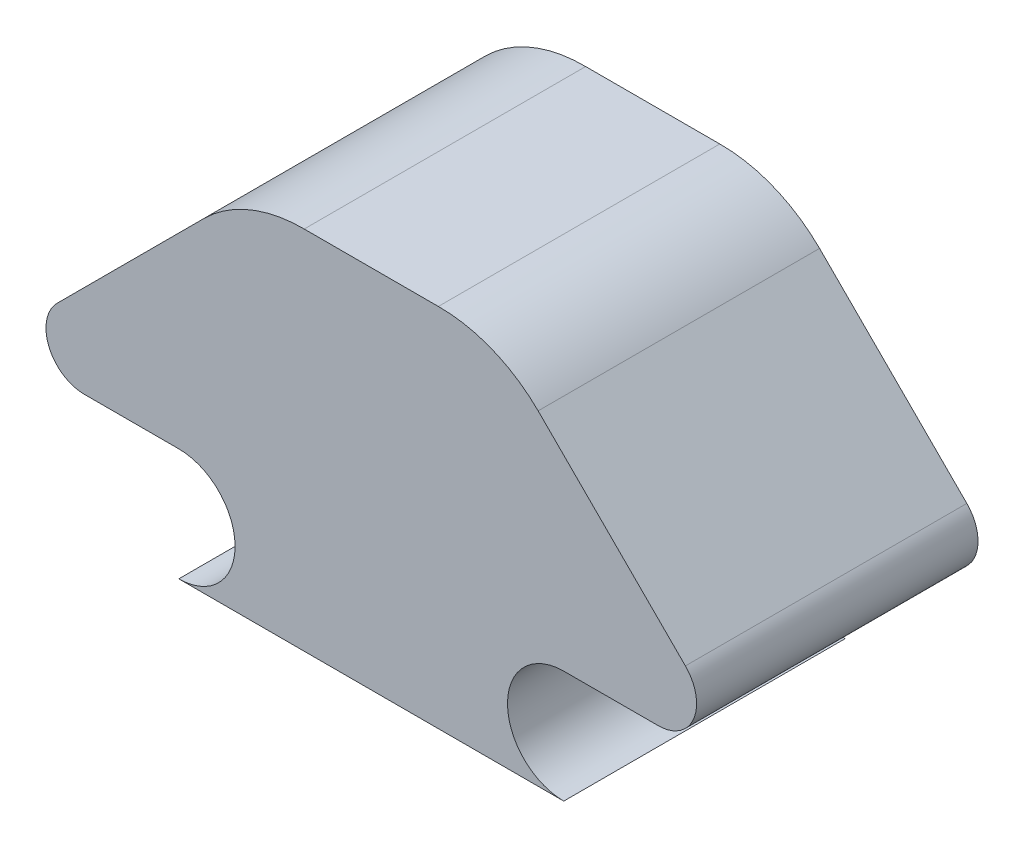
from build123d import *

# Parameters (mm, degrees)
BOSS_EXTRUDE1_DEPTH = 6.35


with BuildPart() as part:
    # Sketch1 → Boss-Extrude1 (new body)
    with BuildSketch(Plane.XY):
        with BuildLine():
            Line((0, 0), (-4.3434, 0))
            ThreePointArc((-4.3434, 0), (-3.0734, 1.27), (-4.3434, 2.54))
            Line((-4.3434, 2.54), (-6.477, 2.54))
            ThreePointArc((-6.477, 2.54), (-7.274862364, 3.073114588), (-7.087657416, 4.014257416))
            Line((-7.087657416, 4.014257416), (-3.764962651, 7.336952181))
            ThreePointArc((-3.764962651, 7.336952181), (-2.730139224, 8.017998618), (-1.513461851, 8.2511937))
            Line((-1.513461851, 8.2511937), (0, 8.2511937))
            Line((0, 8.2511937), (0, 0))
        make_face()
    boss_extrude1 = extrude(amount=-BOSS_EXTRUDE1_DEPTH)

    # Mirror1: Boss-Extrude1 across plane
    add(boss_extrude1.mirror(Plane(origin=(0, 0, 0), x_dir=(0, 0, 1), z_dir=(1, 0, 0))))


solid = part.part
